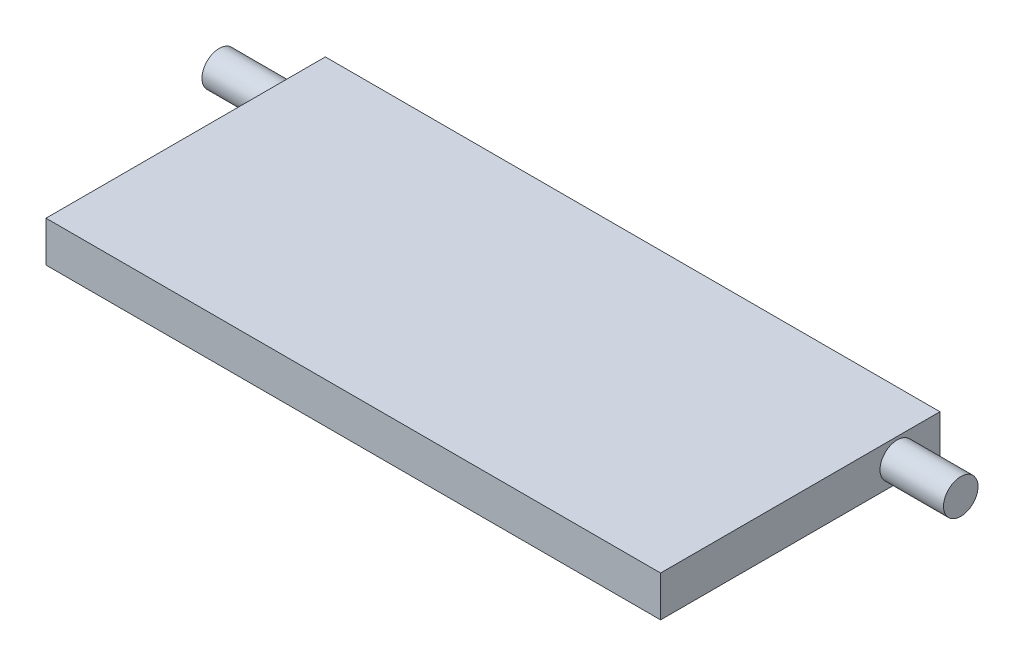
from build123d import *

# Parameters (mm, degrees)
BOSS_EXTRUDE1_DEPTH = 4
SKETCH1_3_W         = 12.5
SKETCH1_3_H         = 3.4


with BuildPart() as part:
    # Sketch1 → Boss-Extrude1 (new, symmetric)
    with BuildSketch(Plane(origin=(0, 0, 0), x_dir=(1, 0, 0), z_dir=(0, 1, 0))):
        Polygon((-60.5, 27.5), (-60.5, 22.5), (-60.5, 19.1), (-60.5, 15.7), (-60.5, -27.5), (60.5, -27.5), (60.5, 27.5), align=None)
    extrude(amount=BOSS_EXTRUDE1_DEPTH, both=True)

    # Sketch1<3> → Revolve1 (revolve)
    with BuildSketch(Plane(origin=(0, 0, 0), x_dir=(1, 0, 0), z_dir=(0, 1, 0))):
        with Locations((-66.75, 20.8)):
            Rectangle(SKETCH1_3_W, SKETCH1_3_H)
    revolve1 = revolve(axis=Axis((-73, 0, -19.1), (1, 0, 0)))

    # Mirror1: Revolve1 across plane
    add(revolve1.mirror(Plane(origin=(0, 0, 0), x_dir=(0, 0, 1), z_dir=(1, 0, 0))))


solid = part.part
